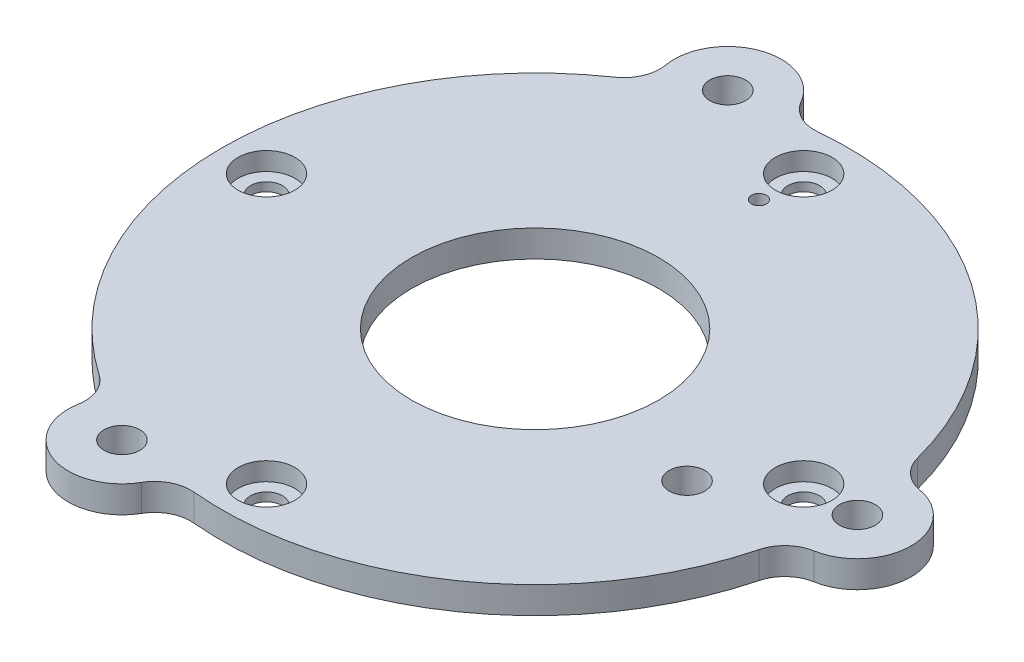
from build123d import *

# Parameters (mm, degrees)
SKETCH1_R                                      = 17.5
BOSS_EXTRUDE1_DEPTH                            = 1.5
CUT_EXTRUDE1_DEPTH                             = 25.794152536
CUT_EXTRUDE1_DEPTH_BACK                        = 25.794152536
SKETCH6_R                                      = 0.42
SKETCH6_R_2                                    = 1
CBORE_FOR_0_SOCKET_HEAD_CAP_SCREW1_D           = 1.778
CBORE_FOR_0_SOCKET_HEAD_CAP_SCREW1_CBORE_D     = 3.175
CBORE_FOR_0_SOCKET_HEAD_CAP_SCREW1_CBORE_DEPTH = 1.016
BOSS_EXTRUDE2_DEPTH                            = 1.5
FILLET1_R                                      = 2
CUT_EXTRUDE2_START                             = -10
SKETCH10_R                                     = 1
CUT_EXTRUDE2_DEPTH                             = 10
SKETCH11_R                                     = 6.9
CUT_EXTRUDE3_DEPTH                             = 10


with BuildPart() as part:
    # Sketch1 → Boss-Extrude1 (new body)
    with BuildSketch(Plane(origin=(0, 0, 0), x_dir=(1, 0, 0), z_dir=(0, 1, 0))):
        with Locations(Location((0, 0, 0), (0, 0, 270))):
            Circle(SKETCH1_R)
    extrude(amount=BOSS_EXTRUDE1_DEPTH)

    # Sketch6 → Cut-Extrude1 (cut, two sides: drawn at the far end of the back side and taken through both)
    with BuildSketch(Plane(origin=(0, 1.5, 0), x_dir=(1, 0, 0), z_dir=(0, 1, 0)).offset(-CUT_EXTRUDE1_DEPTH_BACK)):
        with Locations(Location((0, 12.5, 0), (0, 0, 270))):
            Circle(SKETCH6_R)
        with Locations(Location((11.591109915, -3.105828541, 0), (0, 0, 270))):
            Circle(SKETCH6_R_2)
    extrude(amount=CUT_EXTRUDE1_DEPTH + CUT_EXTRUDE1_DEPTH_BACK, mode=Mode.SUBTRACT)

    # CBORE for #0 Socket Head Cap Screw1 (through all)
    with Locations(Plane(origin=(0, 1.5, 0), x_dir=(1, 0, 0), z_dir=(0, 1, 0))):
        with Locations((0, 15), (-15, 0), (0, -15), (15, 0)):
            CounterBoreHole(CBORE_FOR_0_SOCKET_HEAD_CAP_SCREW1_D / 2, CBORE_FOR_0_SOCKET_HEAD_CAP_SCREW1_CBORE_D / 2, CBORE_FOR_0_SOCKET_HEAD_CAP_SCREW1_CBORE_DEPTH)

    # Sketch9 → Boss-Extrude2 (add)
    with BuildSketch(Plane.XZ):
        with BuildLine():
            ThreePointArc((-3.2615852, 17.702035532), (-7.18242301, 19.733545037), (-8.880129888, 15.657052506))
            Line((-8.880129888, 15.657052506), (-8.706640889, 15.180395398))
            ThreePointArc((-8.706640889, 15.180395398), (-7.758159345, 15.686330469), (-6.780403574, 16.133075571))
            ThreePointArc((-6.780403574, 16.133075571), (-6.498382723, 17.854159795), (-5.176050603, 16.717012297))
            ThreePointArc((-5.176050603, 16.717012297), (-4.139884011, 17.00327499), (-3.0880962, 17.225378424))
            Line((-3.0880962, 17.225378424), (-3.2615852, 17.702035532))
        make_face()
        with BuildLine():
            ThreePointArc((17.242752101, 2.989565186), (17.39377576, 1.925244093), (17.479166667, 0.853658385))
            ThreePointArc((17.479166667, 0.853658385), (19, 0), (17.479166667, -0.853658385))
            ThreePointArc((17.479166667, -0.853658385), (17.39377576, -1.925244093), (17.242752101, -2.989565186))
            Line((17.242752101, -2.989565186), (17.75, -2.989565186))
            ThreePointArc((17.75, -2.989565186), (21, 0), (17.75, 2.989565186))
            Line((17.75, 2.989565186), (17.242752101, 2.989565186))
        make_face()
        with BuildLine():
            ThreePointArc((-8.880129888, -15.657052506), (-7.18242301, -19.733545037), (-3.2615852, -17.702035532))
            Line((-3.2615852, -17.702035532), (-3.0880962, -17.225378424))
            ThreePointArc((-3.0880962, -17.225378424), (-4.139884011, -17.00327499), (-5.176050603, -16.717012297))
            ThreePointArc((-5.176050603, -16.717012297), (-6.498382723, -17.854159795), (-6.780403574, -16.133075571))
            ThreePointArc((-6.780403574, -16.133075571), (-7.758159345, -15.686330469), (-8.706640889, -15.180395398))
            Line((-8.706640889, -15.180395398), (-8.880129888, -15.657052506))
        make_face()
    extrude(amount=-BOSS_EXTRUDE2_DEPTH)

    # Fillet1
    fillet1_edges = [part.edges().sort_by_distance(p)[0] for p in [
        (17.242752101, 0.75, 2.989565186),
        (-3.0880962, 0.75, 17.225378424),
        (-8.706640889, 0.75, 15.180395398),
        (-8.706640889, 0.75, -15.180395398),
        (-3.0880962, 0.75, -17.225378424),
        (17.242752101, 0.75, -2.989565186),
    ]]
    fillet(fillet1_edges, radius=FILLET1_R)

    # Sketch10 → Cut-Extrude2 (cut)
    with BuildSketch(Plane(origin=(0, 1.5, 0), x_dir=(1, 0, 0), z_dir=(0, 1, 0)).offset(CUT_EXTRUDE2_START)):
        with Locations(Location((-6.15636258, 16.914467174, 0), (0, 0, 90))):
            Circle(SKETCH10_R)
        with Locations(Location((18, 0, 0), (0, 0, 90))):
            Circle(SKETCH10_R)
        with Locations(Location((-6.15636258, -16.914467174, 0), (0, 0, 90))):
            Circle(SKETCH10_R)
    extrude(amount=CUT_EXTRUDE2_DEPTH, mode=Mode.SUBTRACT)

    # Sketch11 → Cut-Extrude3 (cut)
    with BuildSketch(Plane(origin=(0, 1.5, 0), x_dir=(1, 0, 0), z_dir=(0, 1, 0))):
        with Locations(Location((0, 0, 0), (0, 0, 270))):
            Circle(SKETCH11_R)
    extrude(amount=-CUT_EXTRUDE3_DEPTH, mode=Mode.SUBTRACT)


solid = part.part
